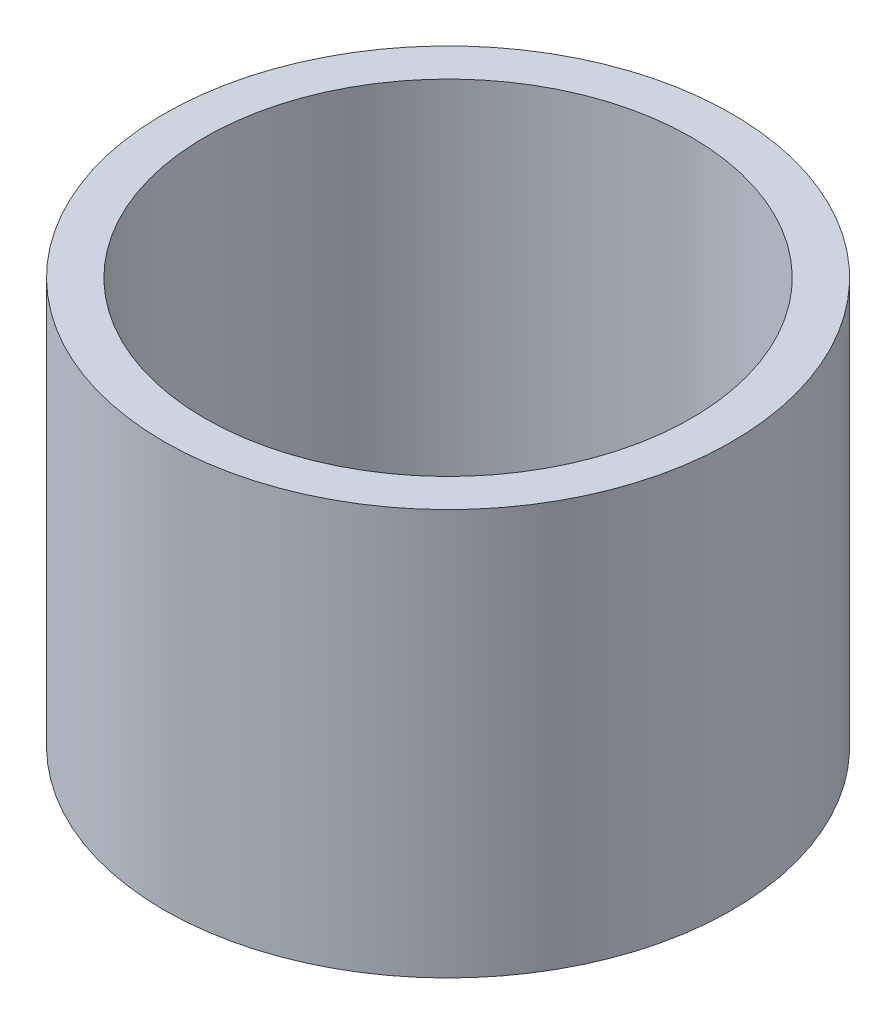
from build123d import *

# Parameters (mm, degrees)
SKETCH1_R           = 7
SKETCH1_R_2         = 6
BOSS_EXTRUDE1_DEPTH = 10


with BuildPart() as part:
    # Sketch1 → Boss-Extrude1 (new body)
    with BuildSketch(Plane(origin=(0, 0, 0), x_dir=(1, 0, 0), z_dir=(0, 1, 0))):
        with Locations(Location((0, 0, 0), (0, 0, 270))):
            Circle(SKETCH1_R)
        with Locations(Location((0, 0, 0), (0, 0, 270))):
            Circle(SKETCH1_R_2, mode=Mode.SUBTRACT)
    extrude(amount=BOSS_EXTRUDE1_DEPTH)


solid = part.part
